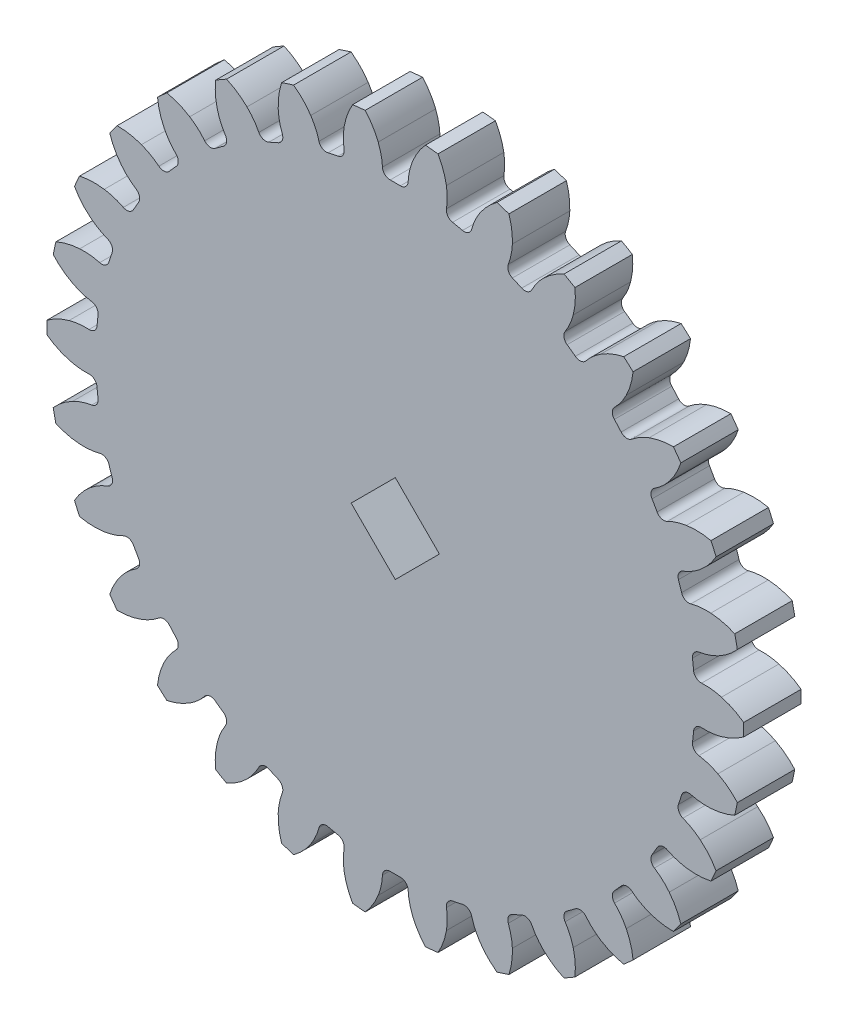
from build123d import *

# Parameters (mm, degrees)
SKETCH1_R          = 35.4470208
GEAR_BASE_DEPTH    = 2.921
GEAR_CUT_DEPTH     = 51.468916485
GEAR_TEETH_COUNT   = 30
CUT_EXTRUDE2_DEPTH = 51.375592363


with BuildPart() as part:
    # Sketch1 → GEAR_BASE (new, symmetric)
    with BuildSketch(Plane.XY):
        Circle(SKETCH1_R)
    extrude(amount=GEAR_BASE_DEPTH, both=True)

    # Sketch2 → GEAR_CUT (cut, through all)
    with BuildSketch(Plane.XY.offset(2.921)):
        with BuildLine():
            ThreePointArc((-34.799897307, -6.742286782), (-35.252838311, -3.705222612), (-35.441236301, -0.64035385))
            ThreePointArc((-35.441236301, -0.64035385), (-34.363578287, -1.292746557), (-33.185985771, -1.740227177))
            ThreePointArc((-33.185985771, -1.740227177), (-32.181645358, -1.93441195), (-31.159102963, -1.962950347))
            ThreePointArc((-31.159102963, -1.962950347), (-30.60933197, -2.151588242), (-30.345108189, -2.669292979))
            ThreePointArc((-30.345108189, -2.669292979), (-30.295407924, -3.184175682), (-30.236971986, -3.698140229))
            ThreePointArc((-30.236971986, -3.698140229), (-30.387784976, -4.259467088), (-30.88632213, -4.558286609))
            ThreePointArc((-30.88632213, -4.558286609), (-31.880586054, -4.798799892), (-32.822605935, -5.197555375))
            ThreePointArc((-32.822605935, -5.197555375), (-33.881428776, -5.880092721), (-34.799897307, -6.742286782))
        make_face()
    gear_cut = extrude(amount=-GEAR_CUT_DEPTH, mode=Mode.SUBTRACT)

    # GEAR_TEETH: GEAR_CUT ×30 about axis
    gear_teeth_axis = Axis((0, 0, 50), (0, 0, -1))
    for i in range(1, GEAR_TEETH_COUNT):
        add(gear_cut.rotate(gear_teeth_axis, i * 360 / GEAR_TEETH_COUNT), mode=Mode.SUBTRACT)

    # Sketch9 → Cut-Extrude2 (cut, through all)
    with BuildSketch(Plane(origin=(0, 0, -2.921), x_dir=(-1, 0, 0), z_dir=(0, 0, -1))):
        Polygon((-4.490128061, 0), (0, -4.490128061), (4.490128061, 0), (0, 4.490128061), align=None)
    extrude(amount=-CUT_EXTRUDE2_DEPTH, mode=Mode.SUBTRACT)


solid = part.part
